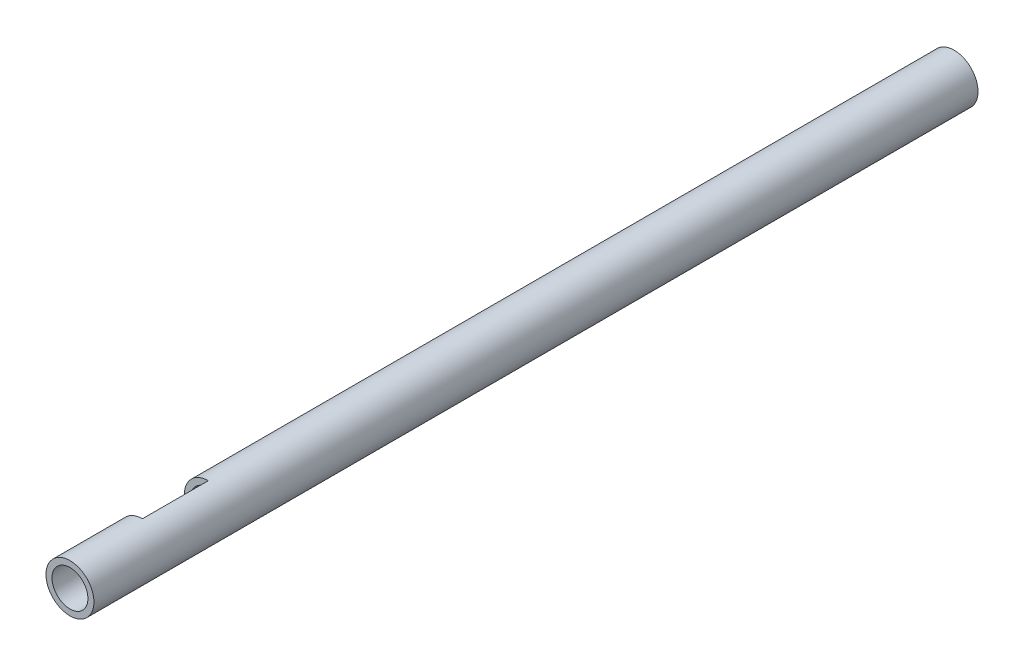
from build123d import *

# Parameters (mm, degrees)
SKETCH1_W               = 738
SKETCH1_H               = 5
CUT_EXTRUDE1_DEPTH      = 739.541806535
CUT_EXTRUDE1_DEPTH_BACK = 739.541806535
SKETCH2_W               = 37.714751534
SKETCH2_H               = 55


with BuildPart() as part:
    # Sketch1 → Revolve1 (revolve)
    with BuildSketch(Plane(origin=(0, 0, 0), x_dir=(0, 0, -1), z_dir=(1, 0, 0)), mode=Mode.PRIVATE) as revolve1_sk:
        with Locations((-369, 17.5)):
            Rectangle(SKETCH1_W, SKETCH1_H)
    revolve(revolve1_sk.sketch.rotate(Axis((0, 0, 0), (0, 0, 1)), 90), axis=Axis((0, 0, 0), (0, 0, 1)))

    # Sketch2 → Cut-Extrude1 (cut, two sides: drawn at the far end of the back side and taken through both)
    with BuildSketch(Plane(origin=(0, 0, 0), x_dir=(1, 0, 0), z_dir=(0, 1, 0)).offset(-CUT_EXTRUDE1_DEPTH_BACK)):
        with Locations((-18.857375767, -650)):
            Rectangle(SKETCH2_W, SKETCH2_H)
    extrude(amount=CUT_EXTRUDE1_DEPTH + CUT_EXTRUDE1_DEPTH_BACK, mode=Mode.SUBTRACT)


solid = part.part
